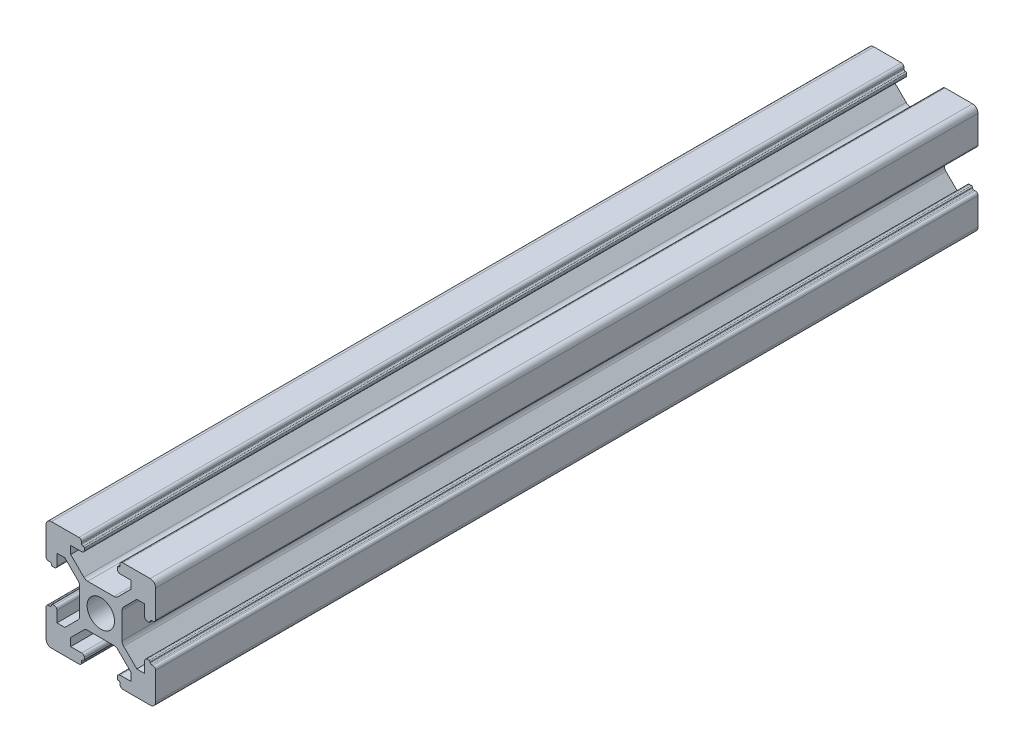
from build123d import *

# Parameters (mm, degrees)
SKETCH2_R           = 2.5
BOSS_EXTRUDE1_DEPTH = 150


with BuildPart() as part:
    # Sketch2 → Boss-Extrude1 (new body)
    with BuildSketch(Plane.XY):
        with BuildLine():
            ThreePointArc((4, 10), (3.646446609, 9.853553391), (3.5, 9.5))
            Line((3.5, 9.5), (3.5, 9.25))
            ThreePointArc((3.5, 9.25), (3.426776695, 9.073223305), (3.25, 9))
            Line((3.25, 9), (3.2, 9))
            ThreePointArc((3.2, 9), (3.058578644, 8.941421356), (3, 8.8))
            Line((3, 8.8), (3, 8.5))
            ThreePointArc((3, 8.5), (3.146446609, 8.146446609), (3.5, 8))
            Line((3.5, 8), (5.5, 8))
            Line((5.5, 8), (5.5, 6.560660172))
            Line((5.5, 6.560660172), (3.107233047, 4.167893219))
            ThreePointArc((3.107233047, 4.167893219), (2.782809698, 3.951120467), (2.400126266, 3.875))
            Line((2.400126266, 3.875), (0, 3.875))
            Line((0, 3.875), (-2.400126266, 3.875))
            ThreePointArc((-2.400126266, 3.875), (-2.782809698, 3.951120467), (-3.107233047, 4.167893219))
            Line((-3.107233047, 4.167893219), (-5.5, 6.560660172))
            Line((-5.5, 6.560660172), (-5.5, 8))
            Line((-5.5, 8), (-3.5, 8))
            ThreePointArc((-3.5, 8), (-3.146446609, 8.146446609), (-3, 8.5))
            Line((-3, 8.5), (-3, 8.8))
            ThreePointArc((-3, 8.8), (-3.058578644, 8.941421356), (-3.2, 9))
            Line((-3.2, 9), (-3.25, 9))
            ThreePointArc((-3.25, 9), (-3.426776695, 9.073223305), (-3.5, 9.25))
            Line((-3.5, 9.25), (-3.5, 9.5))
            ThreePointArc((-3.5, 9.5), (-3.646446609, 9.853553391), (-4, 10))
            Line((-4, 10), (-9, 10))
            ThreePointArc((-9, 10), (-9.707106781, 9.707106781), (-10, 9))
            Line((-10, 9), (-10, 4))
            ThreePointArc((-10, 4), (-9.853553391, 3.646446609), (-9.5, 3.5))
            Line((-9.5, 3.5), (-9.25, 3.5))
            ThreePointArc((-9.25, 3.5), (-9.073223305, 3.426776695), (-9, 3.25))
            Line((-9, 3.25), (-9, 3.2))
            ThreePointArc((-9, 3.2), (-8.941421356, 3.058578644), (-8.8, 3))
            Line((-8.8, 3), (-8.5, 3))
            ThreePointArc((-8.5, 3), (-8.146446609, 3.146446609), (-8, 3.5))
            Line((-8, 3.5), (-8, 5.5))
            Line((-8, 5.5), (-6.560660172, 5.5))
            Line((-6.560660172, 5.5), (-4.167893219, 3.107233047))
            ThreePointArc((-4.167893219, 3.107233047), (-3.951120467, 2.782809698), (-3.875, 2.400126266))
            Line((-3.875, 2.400126266), (-3.875, 0))
            Line((-3.875, 0), (-3.875, -2.400126266))
            ThreePointArc((-3.875, -2.400126266), (-3.951120467, -2.782809698), (-4.167893219, -3.107233047))
            Line((-4.167893219, -3.107233047), (-6.560660172, -5.5))
            Line((-6.560660172, -5.5), (-8, -5.5))
            Line((-8, -5.5), (-8, -3.5))
            ThreePointArc((-8, -3.5), (-8.146446609, -3.146446609), (-8.5, -3))
            Line((-8.5, -3), (-8.8, -3))
            ThreePointArc((-8.8, -3), (-8.941421356, -3.058578644), (-9, -3.2))
            Line((-9, -3.2), (-9, -3.25))
            ThreePointArc((-9, -3.25), (-9.073223305, -3.426776695), (-9.25, -3.5))
            Line((-9.25, -3.5), (-9.5, -3.5))
            ThreePointArc((-9.5, -3.5), (-9.853553391, -3.646446609), (-10, -4))
            Line((-10, -4), (-10, -9))
            ThreePointArc((-10, -9), (-9.707106781, -9.707106781), (-9, -10))
            Line((-9, -10), (-4, -10))
            ThreePointArc((-4, -10), (-3.646446609, -9.853553391), (-3.5, -9.5))
            Line((-3.5, -9.5), (-3.5, -9.25))
            ThreePointArc((-3.5, -9.25), (-3.426776695, -9.073223305), (-3.25, -9))
            Line((-3.25, -9), (-3.2, -9))
            ThreePointArc((-3.2, -9), (-3.058578644, -8.941421356), (-3, -8.8))
            Line((-3, -8.8), (-3, -8.5))
            ThreePointArc((-3, -8.5), (-3.146446609, -8.146446609), (-3.5, -8))
            Line((-3.5, -8), (-5.5, -8))
            Line((-5.5, -8), (-5.5, -6.560660172))
            Line((-5.5, -6.560660172), (-3.107233047, -4.167893219))
            ThreePointArc((-3.107233047, -4.167893219), (-2.782809698, -3.951120467), (-2.400126266, -3.875))
            Line((-2.400126266, -3.875), (0, -3.875))
            Line((0, -3.875), (2.400126266, -3.875))
            ThreePointArc((2.400126266, -3.875), (2.782809698, -3.951120467), (3.107233047, -4.167893219))
            Line((3.107233047, -4.167893219), (5.5, -6.560660172))
            Line((5.5, -6.560660172), (5.5, -8))
            Line((5.5, -8), (3.5, -8))
            ThreePointArc((3.5, -8), (3.146446609, -8.146446609), (3, -8.5))
            Line((3, -8.5), (3, -8.8))
            ThreePointArc((3, -8.8), (3.058578644, -8.941421356), (3.2, -9))
            Line((3.2, -9), (3.25, -9))
            ThreePointArc((3.25, -9), (3.426776695, -9.073223305), (3.5, -9.25))
            Line((3.5, -9.25), (3.5, -9.5))
            ThreePointArc((3.5, -9.5), (3.646446609, -9.853553391), (4, -10))
            Line((4, -10), (9, -10))
            ThreePointArc((9, -10), (9.707106781, -9.707106781), (10, -9))
            Line((10, -9), (10, -4))
            ThreePointArc((10, -4), (9.853553391, -3.646446609), (9.5, -3.5))
            Line((9.5, -3.5), (9.25, -3.5))
            ThreePointArc((9.25, -3.5), (9.073223305, -3.426776695), (9, -3.25))
            Line((9, -3.25), (9, -3.2))
            ThreePointArc((9, -3.2), (8.941421356, -3.058578644), (8.8, -3))
            Line((8.8, -3), (8.5, -3))
            ThreePointArc((8.5, -3), (8.146446609, -3.146446609), (8, -3.5))
            Line((8, -3.5), (8, -5.5))
            Line((8, -5.5), (6.560660172, -5.5))
            Line((6.560660172, -5.5), (4.167893219, -3.107233047))
            ThreePointArc((4.167893219, -3.107233047), (3.951120467, -2.782809698), (3.875, -2.400126266))
            Line((3.875, -2.400126266), (3.875, 0))
            Line((3.875, 0), (3.875, 2.400126266))
            ThreePointArc((3.875, 2.400126266), (3.951120467, 2.782809698), (4.167893219, 3.107233047))
            Line((4.167893219, 3.107233047), (6.560660172, 5.5))
            Line((6.560660172, 5.5), (8, 5.5))
            Line((8, 5.5), (8, 3.5))
            ThreePointArc((8, 3.5), (8.146446609, 3.146446609), (8.5, 3))
            Line((8.5, 3), (8.8, 3))
            ThreePointArc((8.8, 3), (8.941421356, 3.058578644), (9, 3.2))
            Line((9, 3.2), (9, 3.25))
            ThreePointArc((9, 3.25), (9.073223305, 3.426776695), (9.25, 3.5))
            Line((9.25, 3.5), (9.5, 3.5))
            ThreePointArc((9.5, 3.5), (9.853553391, 3.646446609), (10, 4))
            Line((10, 4), (10, 9))
            ThreePointArc((10, 9), (9.707106781, 9.707106781), (9, 10))
            Line((9, 10), (4, 10))
        make_face()
        Circle(SKETCH2_R, mode=Mode.SUBTRACT)
    extrude(amount=BOSS_EXTRUDE1_DEPTH)


solid = part.part
